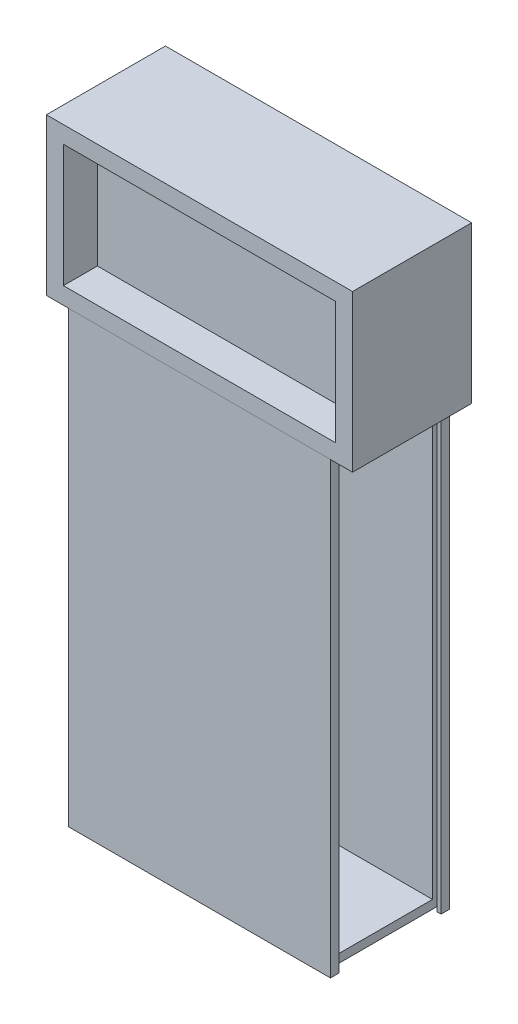
from build123d import *

# Parameters (mm, degrees)
SKETCH1_W           = 77
SKETCH1_H           = 132
BOSS_EXTRUDE1_DEPTH = 35
SKETCH2_W           = 77
SKETCH2_H           = 35
SKETCH2_W_2         = 6.5
BOSS_EXTRUDE3_DEPTH = 46
SHELL4_T            = -2.5
SKETCH3_W           = 80
SKETCH3_H           = 36
CUT_EXTRUDE1_DEPTH  = 10
SKETCH4_W           = 30
SKETCH4_H           = 132
CUT_EXTRUDE2_DEPTH  = 2.5
CUT_EXTRUDE3_START  = -178
SKETCH5_W           = 1.25
SKETCH5_H           = 1.25
CUT_EXTRUDE3_DEPTH  = 178


with BuildPart() as part:
    # Sketch1 → Boss-Extrude1 (new body)
    with BuildSketch(Plane.XY):
        Rectangle(SKETCH1_W, SKETCH1_H)
    extrude(amount=BOSS_EXTRUDE1_DEPTH)

    # Shell4
    shell4_openings = [part.faces().sort_by_distance(p)[0] for p in [
        (38.5, 0, 17.5),
    ]]
    offset(amount=SHELL4_T, openings=shell4_openings, kind=Kind.INTERSECTION)

    # Sketch4 → Cut-Extrude2 (cut)
    with BuildSketch(Plane(origin=(38.5, 0, 0), x_dir=(0, 0, -1), z_dir=(1, 0, 0))):
        with Locations((-17.5, 0)):
            Rectangle(SKETCH4_W, SKETCH4_H)
    extrude(amount=-CUT_EXTRUDE2_DEPTH, mode=Mode.SUBTRACT)

    # Sketch5 → Cut-Extrude3 (cut)
    with BuildSketch(Plane.XZ.offset(66).offset(CUT_EXTRUDE3_START)):
        with Locations((36.625, 33.125)):
            Rectangle(SKETCH5_W, SKETCH5_H)
        with Locations((36.625, 1.875)):
            Rectangle(SKETCH5_W, SKETCH5_H)
    extrude(amount=CUT_EXTRUDE3_DEPTH, mode=Mode.SUBTRACT)


with BuildPart() as body_2:
    # Sketch2 → Boss-Extrude3 (new body)
    with BuildSketch(Plane(origin=(0, 66, 0), x_dir=(1, 0, 0), z_dir=(0, 1, 0))):
        with Locations((0, -17.5)):
            Rectangle(SKETCH2_W, SKETCH2_H)
        with Locations((-41.75, -17.5)):
            Rectangle(SKETCH2_W_2, SKETCH2_H)
        with Locations((41.75, -17.5)):
            Rectangle(SKETCH2_W_2, SKETCH2_H)
    extrude(amount=BOSS_EXTRUDE3_DEPTH)

    # Sketch3 → Cut-Extrude1 (cut)
    with BuildSketch(Plane.XY.offset(35)):
        with Locations((0, 89)):
            Rectangle(SKETCH3_W, SKETCH3_H)
    extrude(amount=-CUT_EXTRUDE1_DEPTH, mode=Mode.SUBTRACT)


solid = Compound([part.part, body_2.part])
